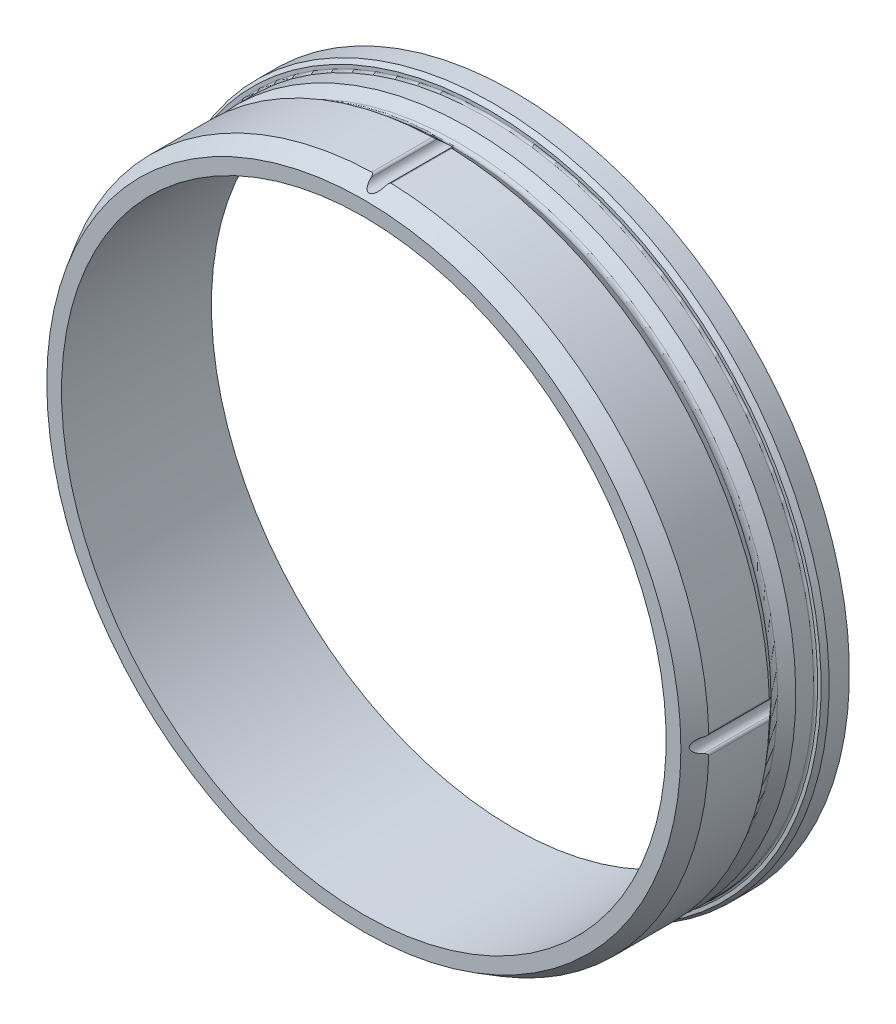
from build123d import *

# Parameters (mm, degrees)
CUT_EXTRUDE1_REACH       = 99.99
FILLET2_R                = 0.5
CIRPATTERN1_COUNT        = 4
FILLET2_OF_CIRPATTERN1_R = 0.5


with BuildPart() as part:
    # Sketch1 → Revolve1 (revolve)
    with BuildSketch(Plane(origin=(0, 0, 0), x_dir=(0, 0, -1), z_dir=(1, 0, 0))):
        with BuildLine():
            Line((0, 66.075), (-4, 66.075))
            Line((-4, 66.075), (-5, 65.497649731))
            Line((-5, 65.497649731), (-5, 64.825))
            ThreePointArc((-5, 64.825), (-5.117157288, 64.542157288), (-5.4, 64.425))
            Line((-5.4, 64.425), (-8.907935936, 64.425))
            Line((-8.907935936, 64.425), (-10.85721239, 62.789362846))
            ThreePointArc((-10.85721239, 62.789362846), (-11.5, 62.555407289), (-12.14278761, 62.789362846))
            Line((-12.14278761, 62.789362846), (-14.092064064, 64.425))
            Line((-14.092064064, 64.425), (-26, 64.425))
            Line((-26, 64.425), (-29.5, 62.404274058))
            Line((-29.5, 62.404274058), (-29.5, 59.5))
            Line((-29.5, 59.5), (0, 59.5))
            Line((0, 59.5), (0, 66.075))
        make_face()
    revolve(axis=Axis((0, 0, 0), (0, 0, 1)))

    # Cut-Extrude1: up to this cone (the profile starts inside it)
    cut_extrude1_end = Plane(origin=(0, 0, 29.5), z_dir=(0, 0, 1)).offset(-92.186660139) * Cone(1e-06, 226.582454778, 270.0304535, align=(Align.CENTER, Align.CENTER, Align.MIN), mode=Mode.PRIVATE)
    # Sketch2 → Cut-Extrude1 (cut, up to the surface)
    with BuildSketch(Plane.XY.offset(29.5), mode=Mode.PRIVATE) as cut_extrude1_sk1:
        with BuildLine():
            Line((-1.5, 71.606143653), (1.5, 71.606143653))
            Line((1.5, 71.606143653), (1.5, 64.5))
            ThreePointArc((1.5, 64.5), (0, 63), (-1.5, 64.5))
            Line((-1.5, 64.5), (-1.5, 71.606143653))
        make_face()
    cut_extrude1_tool1 = extrude(cut_extrude1_sk1.sketch, amount=-CUT_EXTRUDE1_REACH, mode=Mode.PRIVATE) & cut_extrude1_end
    cut_extrude1 = cut_extrude1_tool1.solids().sort_by_distance((0, 67.457258, 29.5))[0]
    add(cut_extrude1, mode=Mode.SUBTRACT)

    # Fillet2
    fillet2_edges = [part.edges().sort_by_distance(p)[0] for p in [
        (1.497151483, 64.407601744, 20.046032018),
        (-1.497151483, 64.407601744, 20.046032018),
    ]]
    fillet(fillet2_edges, radius=FILLET2_R)

    # CirPattern1: Cut-Extrude1 ×4 about axis
    cirpattern1_axis = Axis((0, 0, 0), (0, 0, 1))
    for i in range(1, CIRPATTERN1_COUNT):
        add(cut_extrude1.rotate(cirpattern1_axis, i * 360 / CIRPATTERN1_COUNT), mode=Mode.SUBTRACT)

    # Fillet2 of CirPattern1
    fillet2_of_cirpattern1_edges = [part.edges().sort_by_distance(p)[0] for p in [
        (-64.407601744, 1.497151483, 20.046032018),
        (-64.407601744, -1.497151483, 20.046032018),
        (-1.497151483, -64.407601744, 20.046032018),
        (1.497151483, -64.407601744, 20.046032018),
        (64.407601744, -1.497151483, 20.046032018),
        (64.407601744, 1.497151483, 20.046032018),
    ]]
    fillet(fillet2_of_cirpattern1_edges, radius=FILLET2_OF_CIRPATTERN1_R)


solid = part.part
